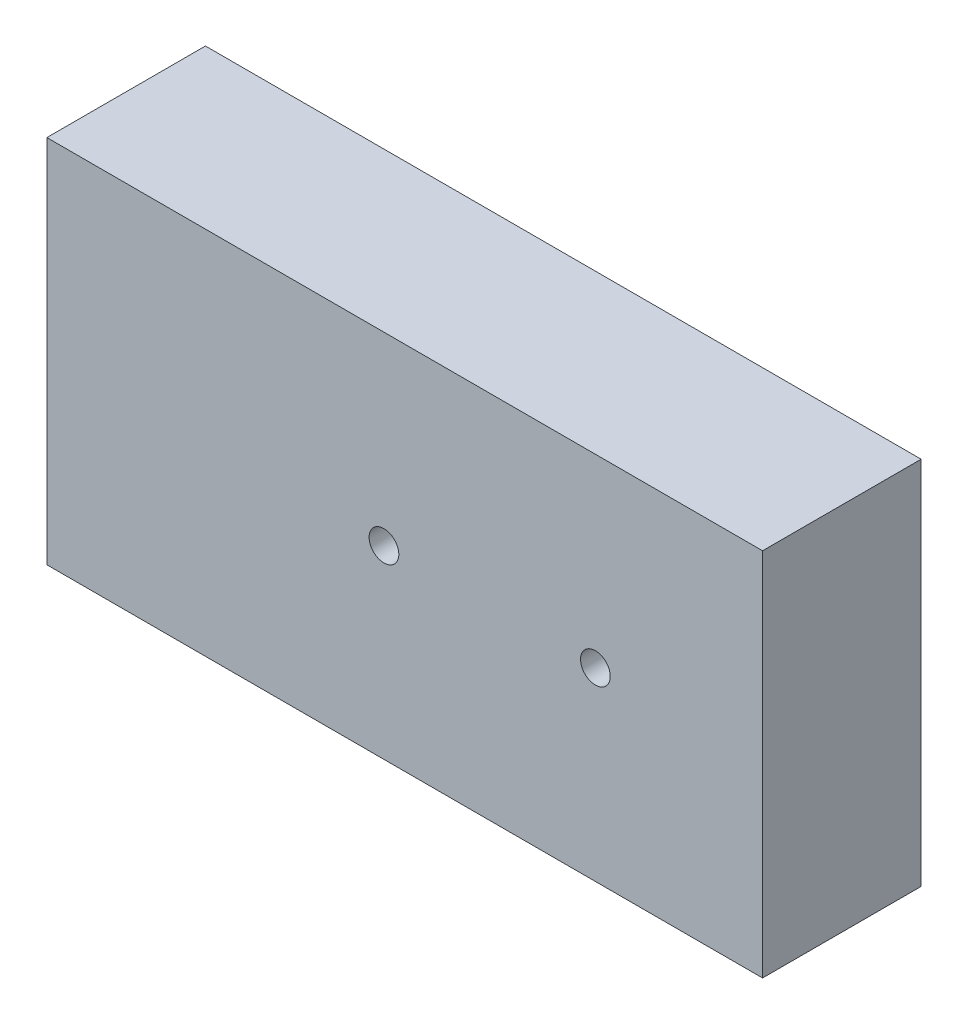
from build123d import *

# Parameters (mm, degrees)
SKETCH1_W           = 38.1
SKETCH1_H           = 88.9
BOSS_EXTRUDE1_DEPTH = 171.958
SKETCH3_R           = 3.571875
CUT_EXTRUDE1_DEPTH  = 198.292609502


with BuildPart() as part:
    # Sketch1 → Boss-Extrude1 (new body)
    with BuildSketch(Plane(origin=(0, 0, 0), x_dir=(0, 0, -1), z_dir=(1, 0, 0))):
        with Locations((19.05, 44.45)):
            Rectangle(SKETCH1_W, SKETCH1_H)
    extrude(amount=BOSS_EXTRUDE1_DEPTH)

    # Sketch3 → Cut-Extrude1 (cut, through all)
    with BuildSketch(Plane(origin=(0, 0, -38.1), x_dir=(-1, 0, 0), z_dir=(0, 0, -1))):
        with Locations((-131.79298, 44.45)):
            Circle(SKETCH3_R)
        with Locations((-80.99298, 44.45)):
            Circle(SKETCH3_R)
    extrude(amount=-CUT_EXTRUDE1_DEPTH, mode=Mode.SUBTRACT)


solid = part.part
